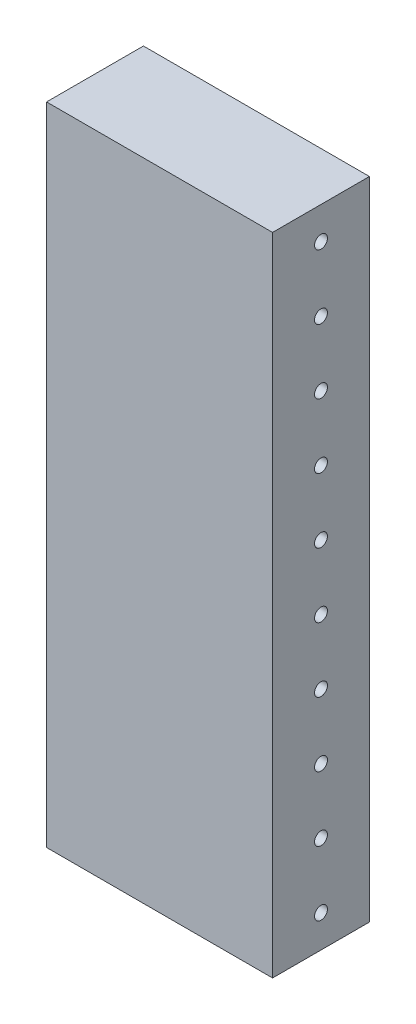
from build123d import *

# Parameters (mm, degrees)
SKETCH1_W           = 88.9
SKETCH1_H           = 38.1
BOSS_EXTRUDE1_DEPTH = 254
SKETCH2_R           = 2.54
CUT_EXTRUDE1_DEPTH  = 272.7918689


with BuildPart() as part:
    # Sketch1 → Boss-Extrude1 (new body)
    with BuildSketch(Plane(origin=(0, 0, 0), x_dir=(1, 0, 0), z_dir=(0, 1, 0))):
        with Locations((44.45, -19.05)):
            Rectangle(SKETCH1_W, SKETCH1_H)
    extrude(amount=BOSS_EXTRUDE1_DEPTH)

    # Sketch2 → Cut-Extrude1 (cut, through all)
    with BuildSketch(Plane.ZY):
        with Locations((19.05, 12.7)):
            Circle(SKETCH2_R)
        with Locations((19.05, 38.1)):
            Circle(SKETCH2_R)
        with Locations((19.05, 63.5)):
            Circle(SKETCH2_R)
        with Locations((19.05, 88.9)):
            Circle(SKETCH2_R)
        with Locations((19.05, 114.3)):
            Circle(SKETCH2_R)
        with Locations((19.05, 139.7)):
            Circle(SKETCH2_R)
        with Locations((19.05, 165.1)):
            Circle(SKETCH2_R)
        with Locations((19.05, 190.5)):
            Circle(SKETCH2_R)
        with Locations((19.05, 215.9)):
            Circle(SKETCH2_R)
        with Locations((19.05, 241.3)):
            Circle(SKETCH2_R)
    extrude(amount=-CUT_EXTRUDE1_DEPTH, mode=Mode.SUBTRACT)


solid = part.part
